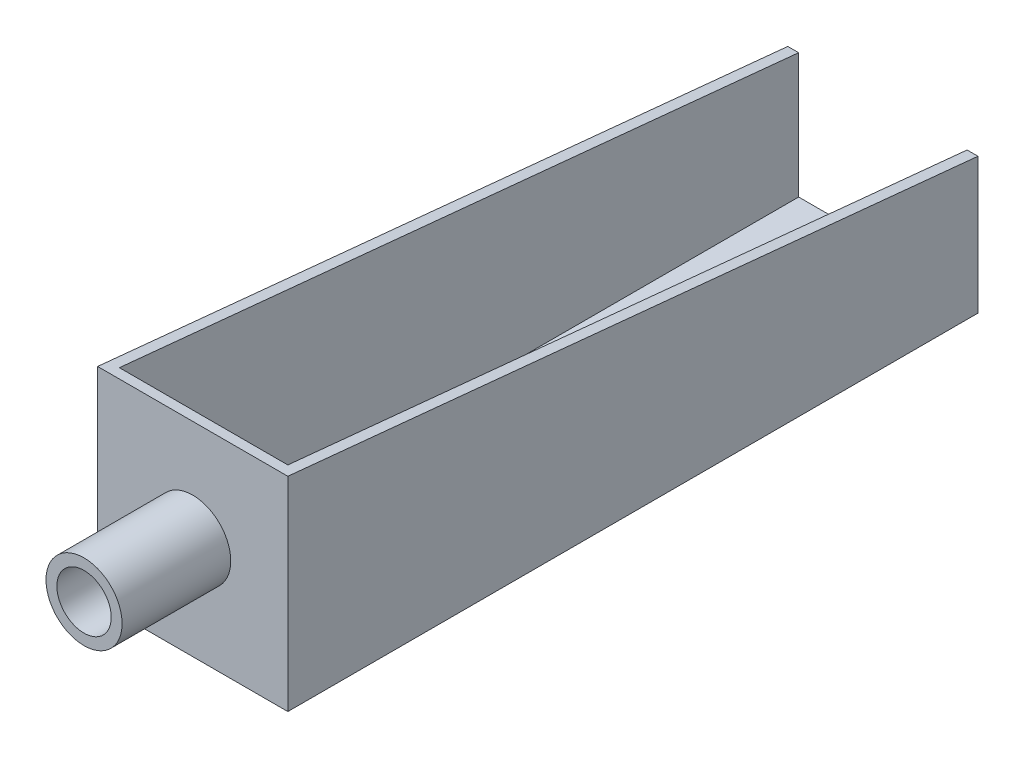
from build123d import *

# Parameters (mm, degrees)
SKETCH_1_W          = 70
SKETCH_1_H          = 75
EXTRUDE_1_DEPTH     = 4
EXTRUDE_2_DEPTH     = 250
CUT_EXTRUDE_1_DEPTH = 263.309454652
SKETCH_4_R          = 14
SKETCH_4_R_2        = 10
EXTRUDE_3_DEPTH     = 40


with BuildPart() as part:
    # 草图1 → 凸台-拉伸1 (new body)
    with BuildSketch(Plane.XY):
        Rectangle(SKETCH_1_W, SKETCH_1_H)
    extrude(amount=EXTRUDE_1_DEPTH)

    # 草图2 → 凸台-拉伸2 (add)
    with BuildSketch(Plane(origin=(0, 0, 0), x_dir=(-1, 0, 0), z_dir=(0, 0, -1))):
        Polygon((35, 37.5), (35, -37.5), (-35, -37.5), (-35, 37.5), (-31, 37.5), (-31, -33.5), (31, -33.5), (31, 37.5), align=None)
    extrude(amount=EXTRUDE_2_DEPTH)

    # 草图3 → 切除-拉伸1 (cut, through all)
    with BuildSketch(Plane.ZY.offset(35)):
        Polygon((4, 37.5), (-250, 37.5), (-250, 12.5), align=None)
    extrude(amount=-CUT_EXTRUDE_1_DEPTH, mode=Mode.SUBTRACT)

    # 草图4 → 凸台-拉伸3 (add)
    with BuildSketch(Plane.XY.offset(4)):
        with Locations(Location((0, 0, 0), (0, 0, 180))):
            Circle(SKETCH_4_R)
        Circle(SKETCH_4_R_2, mode=Mode.SUBTRACT)
    extrude(amount=EXTRUDE_3_DEPTH)


solid = part.part
